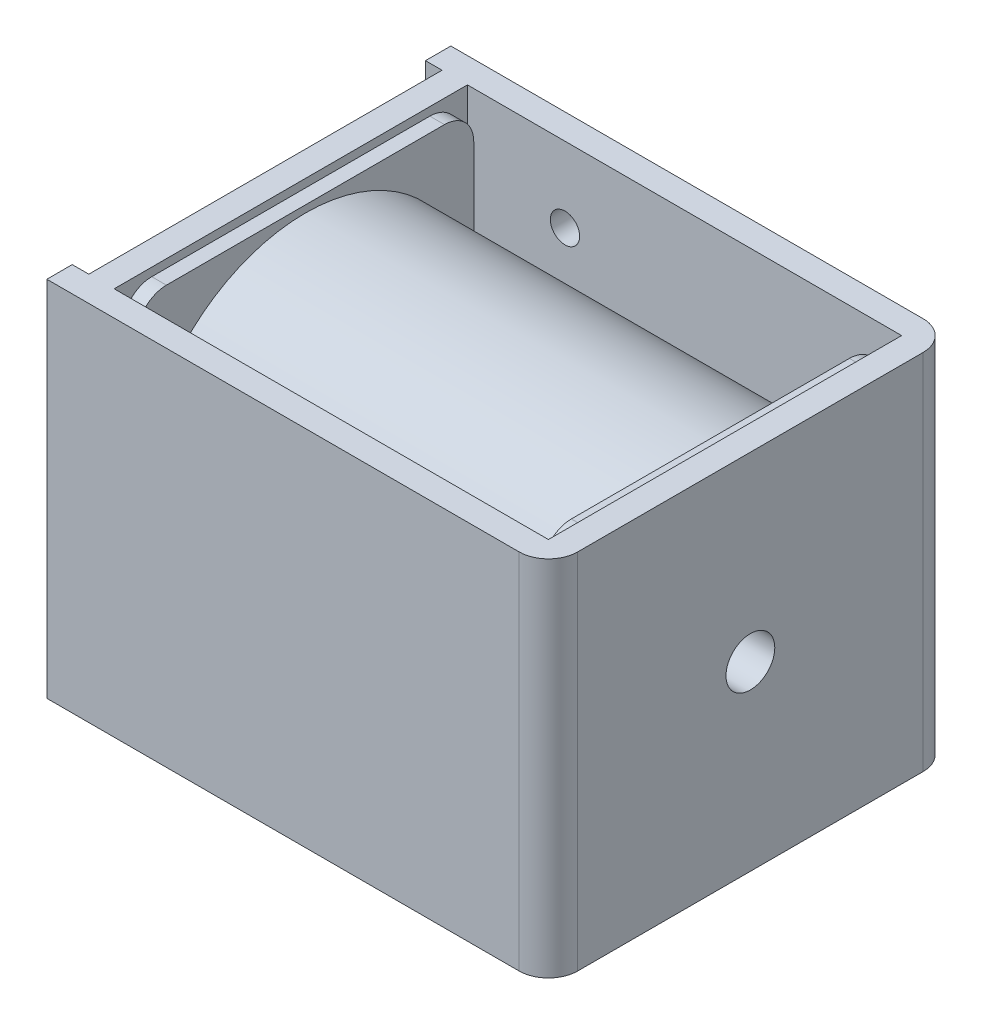
from build123d import *

# Parameters (mm, degrees)
CROQUIS1_W              = 44.5
CROQUIS1_H              = 36.2
SALIENTE_EXTRUIR1_DEPTH = 37.2
CROQUIS2_R              = 17.028823748
SALIENTE_EXTRUIR2_DEPTH = 47.1
CROQUIS3_R              = 17.028823748
SALIENTE_EXTRUIR3_DEPTH = 1.5
REDONDEO1_R             = 3
REDONDEO2_R             = 3
CORTAR_EXTRUIR1_DEPTH   = 2.6


with BuildPart() as part:
    # Croquis1 → Saliente-Extruir1 (new body)
    with BuildSketch(Plane(origin=(0, 0, 0), x_dir=(1, 0, 0), z_dir=(0, 1, 0))):
        Polygon((0, 0), (0, -36.2), (-1.7, -36.2), (-1.7, -38.8), (49.7, -38.8), (49.7, 2.6), (-1.7, 2.6), (-1.7, 0), align=None)
        with Locations((24.85, -18.1)):
            Rectangle(CROQUIS1_W, CROQUIS1_H, mode=Mode.SUBTRACT)
    extrude(amount=SALIENTE_EXTRUIR1_DEPTH)

    # Croquis2 → Saliente-Extruir2 (add)
    with BuildSketch(Plane.ZY):
        with Locations((18.1, 18.6)):
            Circle(CROQUIS2_R)
    extrude(amount=-SALIENTE_EXTRUIR2_DEPTH)

    # Croquis3 → Saliente-Extruir3 (add)
    with BuildSketch(Plane(origin=(2.6, 0, 0), x_dir=(0, 0, -1), z_dir=(1, 0, 0))):
        with BuildLine():
            Line((-0.85, 3.85), (-0.85, 33.35))
            ThreePointArc((-0.85, 33.35), (-1.728679656, 35.471320344), (-3.85, 36.35))
            Line((-3.85, 36.35), (-32.35, 36.35))
            ThreePointArc((-32.35, 36.35), (-34.471320344, 35.471320344), (-35.35, 33.35))
            Line((-35.35, 33.35), (-35.35, 3.85))
            ThreePointArc((-35.35, 3.85), (-34.471320344, 1.728679656), (-32.35, 0.85))
            Line((-32.35, 0.85), (-3.85, 0.85))
            ThreePointArc((-3.85, 0.85), (-1.728679656, 1.728679656), (-0.85, 3.85))
        make_face()
        with Locations(Location((-18.1, 18.6, 0), (0, 0, 180))):
            Circle(CROQUIS3_R, mode=Mode.SUBTRACT)
    saliente_extruir3 = extrude(amount=SALIENTE_EXTRUIR3_DEPTH)

    # Simetría1: Saliente-Extruir3 across plane
    add(saliente_extruir3.mirror(Plane(origin=(24.85, 0, 0), x_dir=(0, 0, 1), z_dir=(1, 0, 0))))

    # Croquis4 → Cortar-Revolución1 (revolve, cut)
    with BuildSketch(Plane(origin=(0, 18.6, 0), x_dir=(1, 0, 0), z_dir=(0, 1, 0))):
        Polygon((49.7, -18.1), (0, -18.1), (0, -11.9), (32.7, -11.9), (32.7, -13.1), (36.9, -13.1), (36.9, -15.6), (49.7, -15.6), align=None)
    revolve(axis=Axis((49.7, 18.6, 18.1), (-1, 0, 0)), mode=Mode.SUBTRACT)

    # Redondeo1
    redondeo1_edges = [part.edges().sort_by_distance(p)[0] for p in [
        (49.7, 18.6, -2.6),
    ]]
    fillet(redondeo1_edges, radius=REDONDEO1_R)

    # Redondeo2
    redondeo2_edges = [part.edges().sort_by_distance(p)[0] for p in [
        (49.7, 18.6, 38.8),
    ]]
    fillet(redondeo2_edges, radius=REDONDEO2_R)

    # Croquis5 → Cortar-Extruir1 (cut)
    with BuildSketch(Plane(origin=(0, 0, -2.6), x_dir=(-1, 0, 0), z_dir=(0, 0, -1))):
        with BuildLine():
            Line((-42.1, 28), (-42.1, 29.5))
            Line((-42.1, 29.5), (-40.6, 29.5))
            ThreePointArc((-40.6, 29.5), (-43.160660172, 30.560660172), (-42.1, 28))
        make_face()
        with BuildLine():
            Line((-40.6, 29.5), (-42.1, 29.5))
            Line((-42.1, 29.5), (-42.1, 28))
            ThreePointArc((-42.1, 28), (-41.039339828, 28.439339828), (-40.6, 29.5))
        make_face()
        with BuildLine():
            ThreePointArc((-40.6, 7.7), (-41.039339828, 8.760660172), (-42.1, 9.2))
            Line((-42.1, 9.2), (-42.1, 7.7))
            Line((-42.1, 7.7), (-40.6, 7.7))
        make_face()
        with BuildLine():
            Line((-42.1, 7.7), (-42.1, 9.2))
            ThreePointArc((-42.1, 9.2), (-43.160660172, 6.639339828), (-40.6, 7.7))
            Line((-40.6, 7.7), (-42.1, 7.7))
        make_face()
        with BuildLine():
            ThreePointArc((-11.1, 7.7), (-11.539339828, 8.760660172), (-12.6, 9.2))
            Line((-12.6, 9.2), (-12.6, 7.7))
            Line((-12.6, 7.7), (-14.1, 7.7))
            ThreePointArc((-14.1, 7.7), (-12.6, 6.2), (-11.1, 7.7))
        make_face()
        with BuildLine():
            Line((-12.6, 7.7), (-12.6, 9.2))
            ThreePointArc((-12.6, 9.2), (-13.660660172, 8.760660172), (-14.1, 7.7))
            Line((-14.1, 7.7), (-12.6, 7.7))
        make_face()
        with BuildLine():
            ThreePointArc((-11.1, 29.5), (-12.6, 31), (-14.1, 29.5))
            Line((-14.1, 29.5), (-12.6, 29.5))
            Line((-12.6, 29.5), (-12.6, 28))
            ThreePointArc((-12.6, 28), (-11.539339828, 28.439339828), (-11.1, 29.5))
        make_face()
        with BuildLine():
            Line((-12.6, 29.5), (-14.1, 29.5))
            ThreePointArc((-14.1, 29.5), (-13.660660172, 28.439339828), (-12.6, 28))
            Line((-12.6, 28), (-12.6, 29.5))
        make_face()
    extrude(amount=-CORTAR_EXTRUIR1_DEPTH, mode=Mode.SUBTRACT)


solid = part.part
